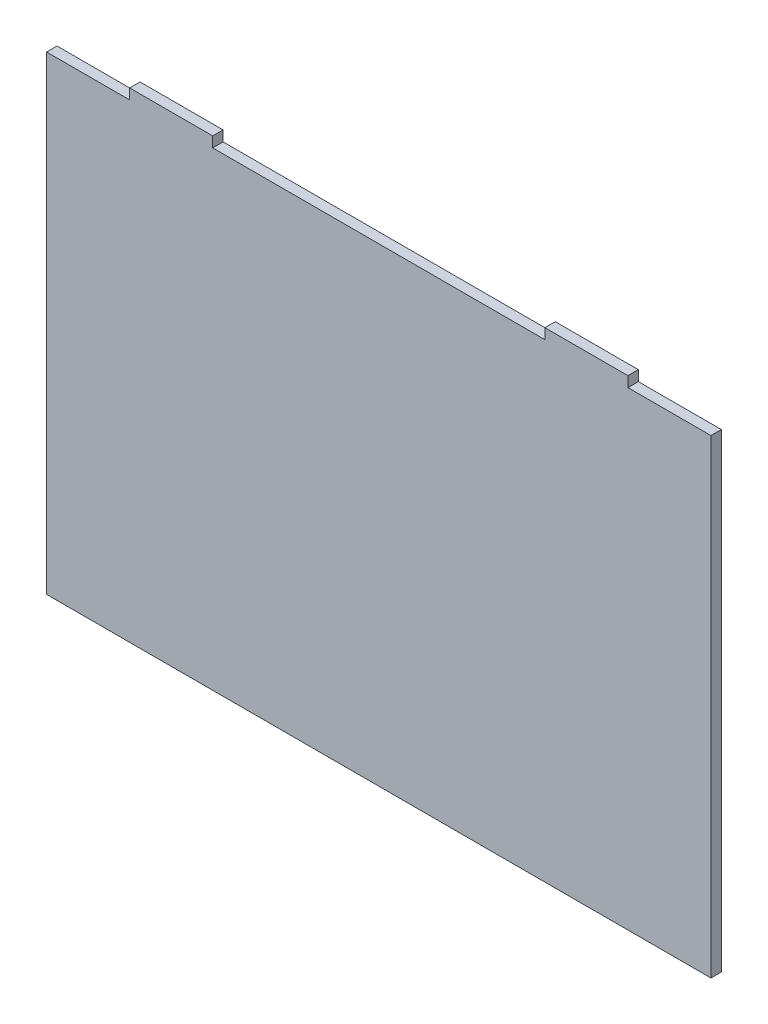
from build123d import *

# Parameters (mm, degrees)
BOSS_EXTRUDE1_DEPTH = 3.175
BOSS_EXTRUDE2_DEPTH = 3.175


with BuildPart() as part:
    # Sketch1 → Boss-Extrude1 (new body)
    with BuildSketch(Plane.XY):
        Polygon((0, 143.6878), (25.4, 143.6878), (25.4, 146.8628), (50.8, 146.8628), (50.8, 143.6878), (152.4, 143.6878), (152.4, 146.8628), (177.8, 146.8628), (177.8, 143.6878), (203.2, 143.6878), (203.2, 0), (0, 0), align=None)
    extrude(amount=BOSS_EXTRUDE1_DEPTH)

    # Sketch1<2> → Boss-Extrude2 (add)
    with BuildSketch(Plane.XY):
        Polygon((0, 143.6878), (25.4, 143.6878), (25.4, 146.8628), (50.8, 146.8628), (50.8, 143.6878), (152.4, 143.6878), (152.4, 146.8628), (177.8, 146.8628), (177.8, 143.6878), (203.2, 143.6878), (203.2, 0), (0, 0), align=None)
    extrude(amount=BOSS_EXTRUDE2_DEPTH)


solid = part.part
